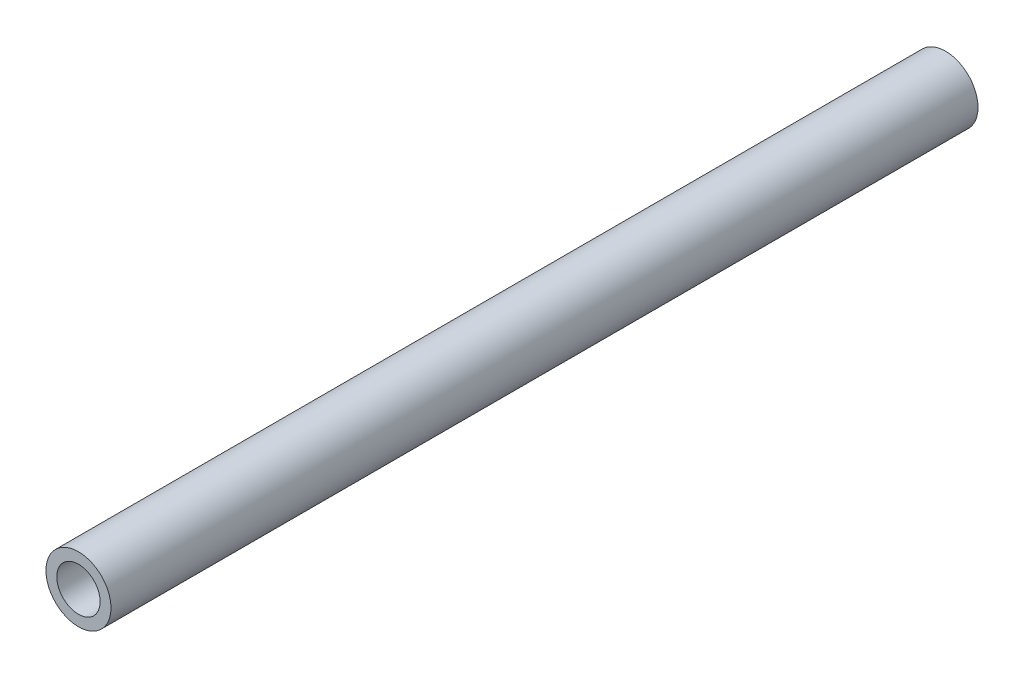
from build123d import *

# Parameters (mm, degrees)
SKETCH1_R           = 3
SKETCH1_R_2         = 2
BOSS_EXTRUDE1_DEPTH = 80


with BuildPart() as part:
    # Sketch1 → Boss-Extrude1 (new body)
    with BuildSketch(Plane.XY):
        Circle(SKETCH1_R)
        Circle(SKETCH1_R_2, mode=Mode.SUBTRACT)
    extrude(amount=BOSS_EXTRUDE1_DEPTH)


solid = part.part
